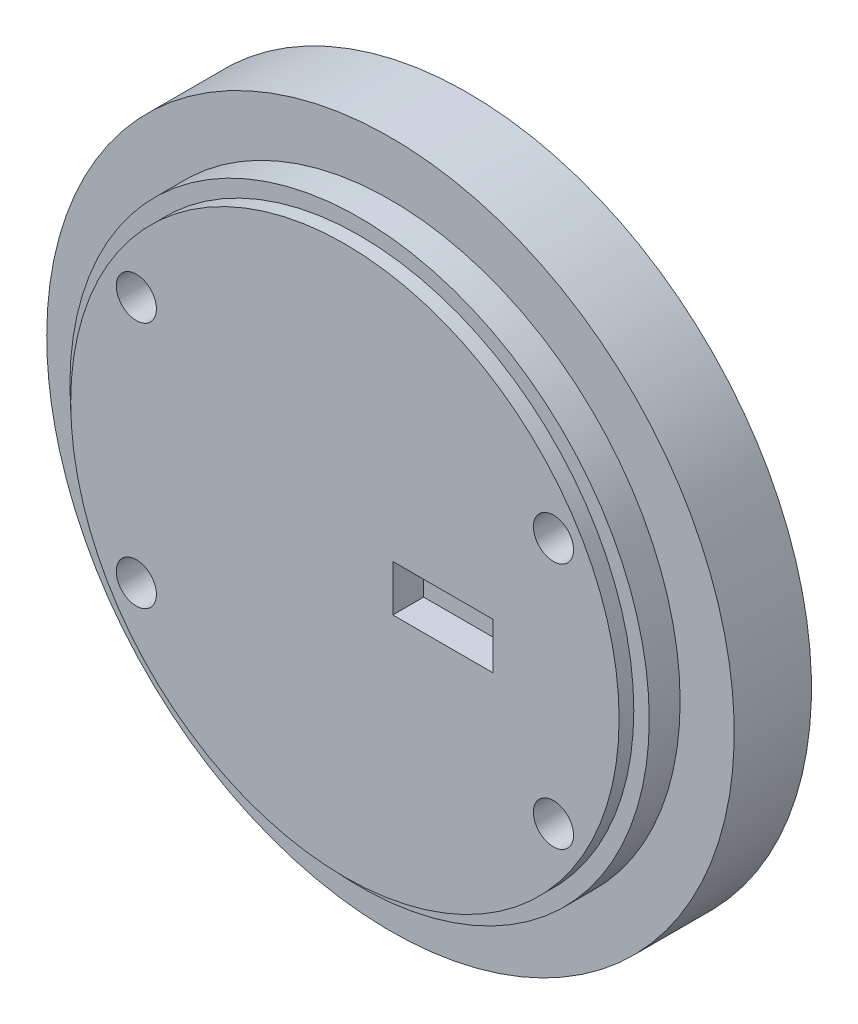
from build123d import *

# Parameters (mm, degrees)
SKETCH_1_R          = 35.5
SKETCH_1_R_2        = 2.6
EXTRUDE_2_DEPTH     = 1.9
EXTRUDE_START       = 4
SKETCH_3_R          = 37.5
SKETCH_3_R_2        = 2.6
EXTRUDE_3_DEPTH     = 4
SKETCH_2_W          = 13
SKETCH_2_H          = 6
CUT_EXTRUDE_6_DEPTH = 4
SKETCH_4_R          = 44.5
SKETCH_4_R_2        = 2
EXTRUDE_4_DEPTH     = 10
SKETCH_7_R          = 2.6
CUT_EXTRUDE_7_DEPTH = 65.910014636
SKETCH_10_R         = 5
CUT_EXTRUDE_8_DEPTH = 6.18
SKETCH_12_R         = 2
EXTRUDE_6_DEPTH     = 2
CUT_EXTRUDE_9_DEPTH = 2.5


with BuildPart() as part:
    # 草图1 → 凸台-拉伸2 (new body)
    with BuildSketch(Plane.XY):
        with Locations(Location((0, 0, 0), (0, 0, 180))):
            Circle(SKETCH_1_R)
        with Locations(Location((-27, 16, 0), (0, 0, 180))):
            Circle(SKETCH_1_R_2, mode=Mode.SUBTRACT)
        with Locations(Location((-27, -16, 0), (0, 0, 180))):
            Circle(SKETCH_1_R_2, mode=Mode.SUBTRACT)
        with Locations(Location((27, -16, 0), (0, 0, 180))):
            Circle(SKETCH_1_R_2, mode=Mode.SUBTRACT)
        with Locations(Location((27, 16, 0), (0, 0, 180))):
            Circle(SKETCH_1_R_2, mode=Mode.SUBTRACT)
    extrude(amount=EXTRUDE_2_DEPTH)

    # 草图3 → 凸台-拉伸3 (add)
    with BuildSketch(Plane(origin=(0, 0, 0), x_dir=(-1, 0, 0), z_dir=(0, 0, -1)).offset(EXTRUDE_START)):
        Circle(SKETCH_3_R)
        with Locations((27, 16)):
            Circle(SKETCH_3_R_2, mode=Mode.SUBTRACT)
        with Locations((27, -16)):
            Circle(SKETCH_3_R_2, mode=Mode.SUBTRACT)
        with Locations((-27, -16)):
            Circle(SKETCH_3_R_2, mode=Mode.SUBTRACT)
        with Locations((-27, 16)):
            Circle(SKETCH_3_R_2, mode=Mode.SUBTRACT)
    extrude(amount=-EXTRUDE_3_DEPTH)

    # 草图2 → 切除-拉伸6 (cut)
    with BuildSketch(Plane.XY.offset(1.9)):
        with Locations((12.7, 0)):
            Rectangle(SKETCH_2_W, SKETCH_2_H)
    extrude(amount=-CUT_EXTRUDE_6_DEPTH, mode=Mode.SUBTRACT)

    # 草图4 → 凸台-拉伸4 (add)
    with BuildSketch(Plane(origin=(0, 0, -4), x_dir=(-1, 0, 0), z_dir=(0, 0, -1))):
        Circle(SKETCH_4_R)
        with Locations((0, 40.5)):
            Circle(SKETCH_4_R_2, mode=Mode.SUBTRACT)
        with Locations((35.074028853, 20.25)):
            Circle(SKETCH_4_R_2, mode=Mode.SUBTRACT)
        with Locations((35.074028853, -20.25)):
            Circle(SKETCH_4_R_2, mode=Mode.SUBTRACT)
        with Locations((0, -40.5)):
            Circle(SKETCH_4_R_2, mode=Mode.SUBTRACT)
        with Locations((-35.074028853, -20.25)):
            Circle(SKETCH_4_R_2, mode=Mode.SUBTRACT)
        with Locations((-35.074028853, 20.25)):
            Circle(SKETCH_4_R_2, mode=Mode.SUBTRACT)
    extrude(amount=EXTRUDE_4_DEPTH)

    # 草图7 → 切除-拉伸7 (cut, through all)
    with BuildSketch(Plane.XY.offset(1.9)):
        with Locations(Location((27, -16, 0), (0, 0, 180))):
            Circle(SKETCH_7_R)
        with Locations(Location((27, 16, 0), (0, 0, 180))):
            Circle(SKETCH_7_R)
        with Locations(Location((-27, -16, 0), (0, 0, 180))):
            Circle(SKETCH_7_R)
        with Locations(Location((-27, 16, 0), (0, 0, 180))):
            Circle(SKETCH_7_R)
    extrude(amount=-CUT_EXTRUDE_7_DEPTH, mode=Mode.SUBTRACT)

    # 草图10 → 切除-拉伸8 (cut)
    with BuildSketch(Plane(origin=(0, 0, -14), x_dir=(-1, 0, 0), z_dir=(0, 0, -1))):
        with Locations((-27, 16)):
            Circle(SKETCH_10_R)
        with Locations(Location((27, 16, 0), (0, 0, 180))):
            Circle(SKETCH_10_R)
        with Locations((27, -16)):
            Circle(SKETCH_10_R)
        with Locations(Location((-27, -16, 0), (0, 0, 180))):
            Circle(SKETCH_10_R)
    extrude(amount=-CUT_EXTRUDE_8_DEPTH, mode=Mode.SUBTRACT)

    # 草图12 → 凸台-拉伸6 (add)
    with BuildSketch(Plane.XY.offset(-4)):
        with Locations((35.074028853, -20.25)):
            Circle(SKETCH_12_R)
        with Locations((35.074028853, 20.25)):
            Circle(SKETCH_12_R)
        with Locations((0, 40.5)):
            Circle(SKETCH_12_R)
        with Locations((-35.074028853, 20.25)):
            Circle(SKETCH_12_R)
        with Locations((-35.074028853, -20.25)):
            Circle(SKETCH_12_R)
        with Locations((0, -40.5)):
            Circle(SKETCH_12_R)
    extrude(amount=-EXTRUDE_6_DEPTH)

    # 草图13 → 切除-拉伸9 (cut)
    with BuildSketch(Plane(origin=(0, 0, -14), x_dir=(-1, 0, 0), z_dir=(0, 0, -1))):
        Polygon((47.534196194, -12), (42.851487722, -12), (36.070038026, -12), (31.570038026, -12), (31.570038026, -10), (28.361849592, -10), (28.361849592, 10), (31.570038026, 10), (31.570038026, 12), (36.070038026, 12), (42.851487722, 12), (47.534196194, 12), align=None)
    extrude(amount=-CUT_EXTRUDE_9_DEPTH, mode=Mode.SUBTRACT)


solid = part.part
